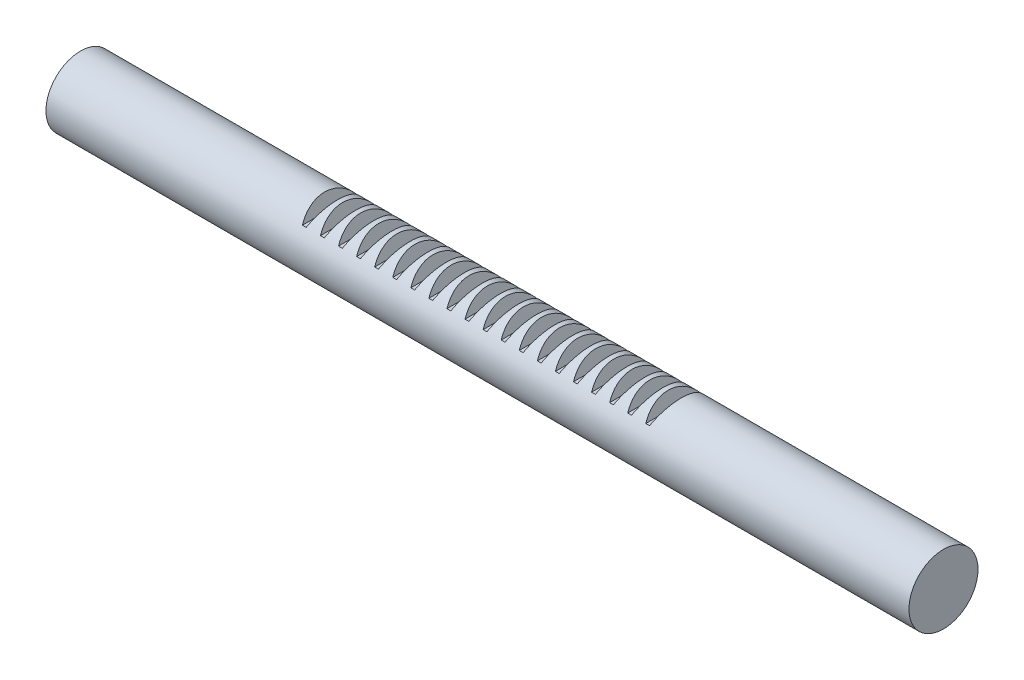
from build123d import *

# Parameters (mm, degrees)
BOSS_EXTRUDE1_DEPTH      = 150
BOSS_EXTRUDE1_DEPTH_BACK = 150
SKETCH1_R                = 12
CUT_EXTRUDE1_DEPTH       = 151.956947505
LPATTERN1_COUNT          = 20
LPATTERN1_PITCH          = 6.283185307


with BuildPart() as part:
    # Sketch1 → Boss-Extrude1 (new, two sides: drawn at the far end of the back side and taken through both)
    with BuildSketch(Plane(origin=(0, 0, 0), x_dir=(0, 0, -1), z_dir=(1, 0, 0)).offset(-BOSS_EXTRUDE1_DEPTH_BACK)):
        Circle(SKETCH1_R)
    extrude(amount=BOSS_EXTRUDE1_DEPTH + BOSS_EXTRUDE1_DEPTH_BACK)

    # Sketch2 → Cut-Extrude1 (cut, symmetric)
    with BuildSketch(Plane.XY):
        Polygon((-62.170982331, 7.5), (-63.492723813, 7.5), (-65.130589867, 12), (-60.533116276, 12), align=None)
    cut_extrude1 = extrude(amount=CUT_EXTRUDE1_DEPTH, both=True, mode=Mode.SUBTRACT)

    # LPattern1: Cut-Extrude1 ×20
    with Locations(*[(i * LPATTERN1_PITCH, 0, 0) for i in range(1, LPATTERN1_COUNT)]):
        add(cut_extrude1, mode=Mode.SUBTRACT)


solid = part.part
